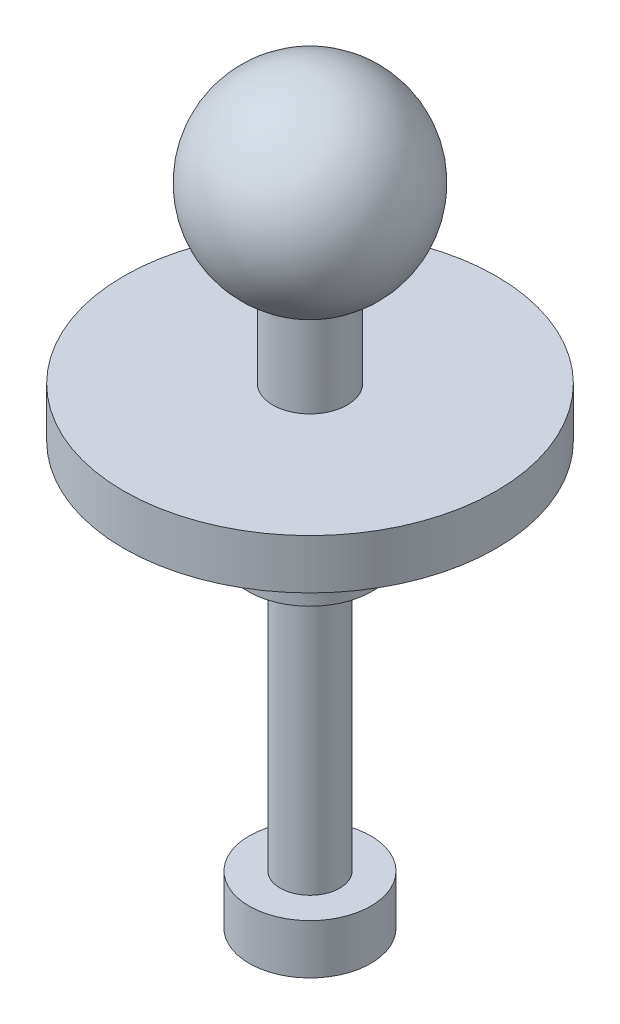
from build123d import *
from build123d.topology import SkipClean

# Parameters (mm, degrees)
SKETCH3_R           = 7.5
BOSS_EXTRUDE1_DEPTH = 2


with BuildPart() as part:
    # Sketch3 → Boss-Extrude1 (new body)
    with BuildSketch(Plane(origin=(0, 0, 0), x_dir=(1, 0, 0), z_dir=(0, 1, 0))):
        with Locations(Location((0, 0, 0), (0, 0, 270))):
            Circle(SKETCH3_R)
    extrude(amount=-BOSS_EXTRUDE1_DEPTH)

    # Sketch4 → Revolve3 (revolve)
    with BuildSketch(Plane.XY):
        Polygon((0, -2), (0, -19), (-2.45, -19), (-2.45, -17), (-1.2, -17), (-1.2, -6), (-2.5, -6), (-2.5, -4.5), (-1.2, -4.5), (-1.2, -4), (-4, -2), align=None)
    revolve(axis=Axis((0, -2, 0), (0, -1, 0)))

    # Sketch5 → Revolve4 (revolve)
    with SkipClean():  # the faces are left unmerged after this step: merging them gives an invalid solid
        with BuildSketch(Plane(origin=(0, 0, 0), x_dir=(0, 0, -1), z_dir=(1, 0, 0)), mode=Mode.PRIVATE) as revolve4_sk:
            with BuildLine():
                ThreePointArc((-1.5, 3.4), (-0.764852927, 3.175735365), (0, 3.1))
                Line((0, 3.1), (0, 7))
                Line((0, 7), (0, 10.9))
                ThreePointArc((0, 10.9), (-3.824264635, 7.764852927), (-1.5, 3.4))
            make_face()
            with BuildLine():
                Line((0, 7), (0, 3.1))
                ThreePointArc((0, 3.1), (0.764852927, 3.175735365), (1.5, 3.4))
                ThreePointArc((1.5, 3.4), (3.244996148, 4.836669235), (3.9, 7))
                ThreePointArc((3.9, 7), (2.757716447, 9.757716447), (0, 10.9))
                Line((0, 10.9), (0, 7))
            make_face()
            with BuildLine():
                Line((-1.5, 0), (0, 0))
                Line((0, 0), (0, 3.1))
                ThreePointArc((0, 3.1), (-0.764852927, 3.175735365), (-1.5, 3.4))
                Line((-1.5, 3.4), (-1.5, 0))
            make_face()
        revolve(revolve4_sk.sketch.rotate(Axis((0, 10.9, 0), (0, -1, 0)), 180), axis=Axis((0, 10.9, 0), (0, -1, 0)))


solid = part.part
